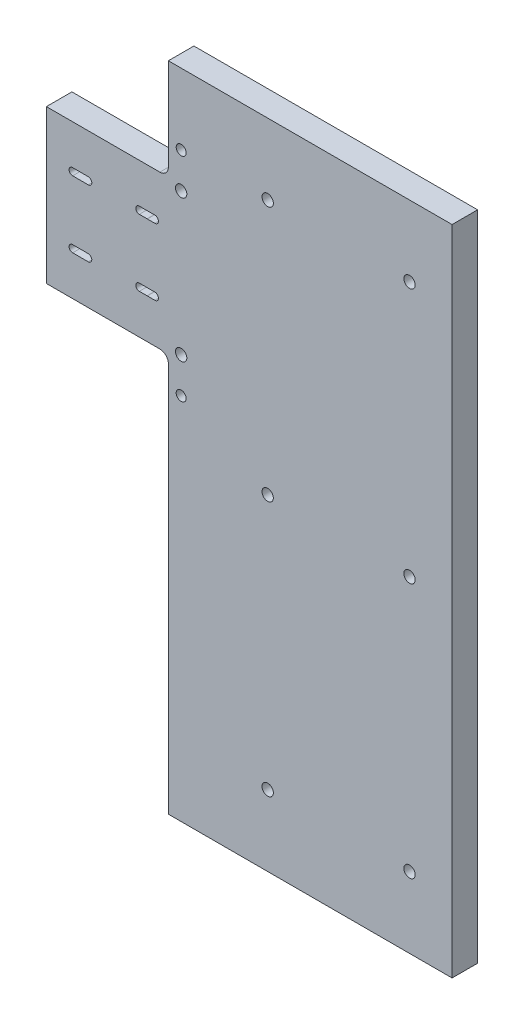
from build123d import *

# Parameters (mm, degrees)
SKETCH1_W                   = 200
SKETCH1_H                   = 460
BOSS_EXTRUDE1_DEPTH         = 18
OTWORY_USTALAJ_CE_8_0MM1_D  = 8
OTW_R_7_0_7_1_D             = 7
OTW_R_5_0_5_1_D             = 5
OTW_R_5_0_5_1_DEPTH         = 45
OTW_R_5_0_5_1_TIP           = 1.502151548
DODANIE_WYCI_GNI_CIE1_DEPTH = 18
OTW_R_5_0_5_2_D             = 5
WYTNIJ_WYCI_GNI_CIE1_DEPTH  = 297.344394244
OTW_R_8_0_8_1_D             = 8
OTW_R_8_0_8_1_DEPTH         = 15
OTW_R_8_0_8_1_TIP           = 2.403442476
OTW_R_8_0_8_2_D             = 8
OTW_R_8_0_8_2_DEPTH         = 22
OTW_R_8_0_8_2_TIP           = 2.403442476


with BuildPart() as part:
    # Sketch1 → Boss-Extrude1 (new body)
    with BuildSketch(Plane.XY):
        Rectangle(SKETCH1_W, SKETCH1_H)
    extrude(amount=BOSS_EXTRUDE1_DEPTH)

    # Otwory ustalające Ø8.0mm1 (through all)
    with Locations(Plane(origin=(0, 0, 0), x_dir=(-1, 0, 0), z_dir=(0, 0, -1))):
        with Locations((-70, 180), (-70, 0), (-70, -180), (30, -180), (30, 0), (30, 180)):
            Hole(OTWORY_USTALAJ_CE_8_0MM1_D / 2)

    # Otwór Ø7.0 (7)1 (through all)
    with Locations(Plane.XY.offset(18)):
        with Locations((-91, 180), (-91, 30)):
            Hole(OTW_R_7_0_7_1_D / 2)

    # Otwór Ø5.0 (5)1
    with Locations(Plane(origin=(0, -230, 0), x_dir=(-1, 0, 0), z_dir=(0, -1, 0))):
        with Locations((50, -9), (-50, -9)):
            Hole(OTW_R_5_0_5_1_D / 2, depth=OTW_R_5_0_5_1_DEPTH)
            with Locations((0, 0, -(OTW_R_5_0_5_1_DEPTH + OTW_R_5_0_5_1_TIP / 2))):  # 118° drill point
                Cone(0, OTW_R_5_0_5_1_D / 2, OTW_R_5_0_5_1_TIP, mode=Mode.SUBTRACT)

    # Szkic8 → Dodanie-wyciągnięcie1 (add)
    with BuildSketch(Plane.XY.offset(18)):
        with BuildLine():
            Line((-100, 165), (-100, 45))
            ThreePointArc((-100, 45), (-101.757359313, 49.242640687), (-106, 51))
            Line((-106, 51), (-186, 51))
            Line((-186, 51), (-186, 159))
            Line((-186, 159), (-106, 159))
            ThreePointArc((-106, 159), (-101.757359313, 160.757359313), (-100, 165))
        make_face()
    extrude(amount=-DODANIE_WYCI_GNI_CIE1_DEPTH)

    # Otwór Ø5.0 (5)2 (through all)
    with Locations(Plane.XY.offset(18)):
        with Locations((-161.928446298, 128.5), (-114.928446334, 128.498158688), (-114.928446334, 81.498158688), (-161.928446298, 81.5)):
            Hole(OTW_R_5_0_5_2_D / 2)

    # Szkic11 → Wytnij-wyciągnięcie1 (cut, through all)
    with BuildSketch(Plane(origin=(0, 0, 0), x_dir=(-1, 0, 0), z_dir=(0, 0, -1))):
        with BuildLine():
            Line((109.5, 131), (120.5, 131))
            ThreePointArc((120.5, 131), (123, 128.5), (120.5, 126))
            Line((120.5, 126), (109.5, 126))
            ThreePointArc((109.5, 126), (107, 128.5), (109.5, 131))
        make_face()
        with BuildLine():
            Line((156.5, 131), (167.5, 131))
            ThreePointArc((167.5, 131), (170, 128.5), (167.5, 126))
            Line((167.5, 126), (156.5, 126))
            ThreePointArc((156.5, 126), (154, 128.5), (156.5, 131))
        make_face()
        with BuildLine():
            Line((109.5, 84), (120.5, 84))
            ThreePointArc((120.5, 84), (123, 81.5), (120.5, 79))
            Line((120.5, 79), (109.5, 79))
            ThreePointArc((109.5, 79), (107, 81.5), (109.5, 84))
        make_face()
        with BuildLine():
            Line((156.5, 84), (167.5, 84))
            ThreePointArc((167.5, 84), (170, 81.5), (167.5, 79))
            Line((167.5, 79), (156.5, 79))
            ThreePointArc((156.5, 79), (154, 81.5), (156.5, 84))
        make_face()
    extrude(amount=-WYTNIJ_WYCI_GNI_CIE1_DEPTH, mode=Mode.SUBTRACT)

    # Otwór Ø8.0 (8)1
    with Locations(Plane.XY.offset(18)):
        with Locations((-91, 155), (-91, 55)):
            Hole(OTW_R_8_0_8_1_D / 2, depth=OTW_R_8_0_8_1_DEPTH)
            with Locations((0, 0, -(OTW_R_8_0_8_1_DEPTH + OTW_R_8_0_8_1_TIP / 2))):  # 118° drill point
                Cone(0, OTW_R_8_0_8_1_D / 2, OTW_R_8_0_8_1_TIP, mode=Mode.SUBTRACT)

    # Otwór Ø8.0 (8)2
    with Locations(Plane(origin=(0, -230, 0), x_dir=(-1, 0, 0), z_dir=(0, -1, 0))):
        with Locations((0, -9)):
            Hole(OTW_R_8_0_8_2_D / 2, depth=OTW_R_8_0_8_2_DEPTH)
            with Locations((0, 0, -(OTW_R_8_0_8_2_DEPTH + OTW_R_8_0_8_2_TIP / 2))):  # 118° drill point
                Cone(0, OTW_R_8_0_8_2_D / 2, OTW_R_8_0_8_2_TIP, mode=Mode.SUBTRACT)


solid = part.part
